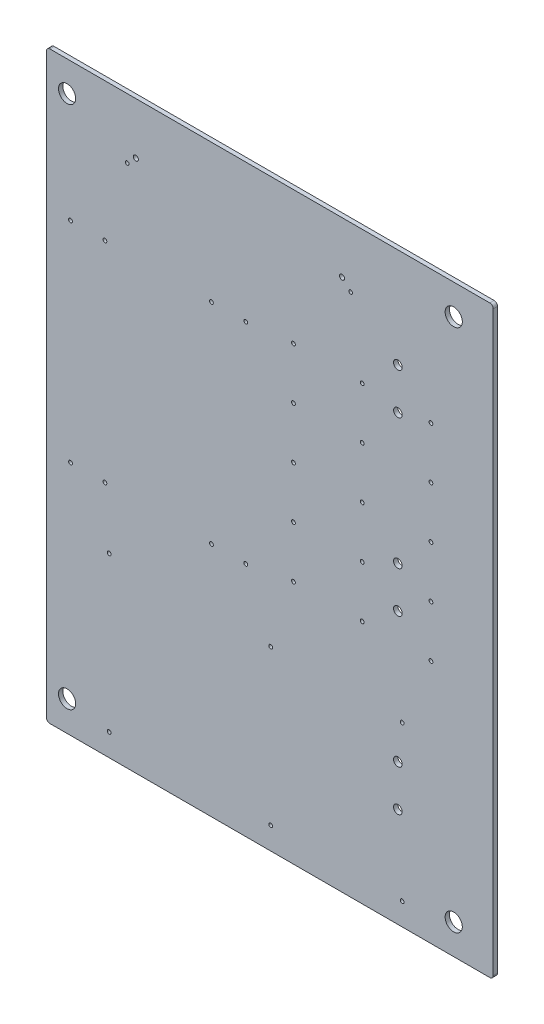
from build123d import *

# Parameters (mm, degrees)
SKETCH1_R                       = 6.35
SKETCH1_R_2                     = 3.175
SKETCH1_R_3                     = 1.8669
EXTRUDE1_DEPTH                  = 3.175
F_4_40_TAPPED_HOLE1_D           = 2.2606
F_4_40_TAPPED_HOLE1_DEPTH       = 8.8646
F_4_40_TAPPED_HOLE1_CBORE_D     = 2.8448
F_4_40_TAPPED_HOLE1_CBORE_DEPTH = 5.6896
F_4_40_TAPPED_HOLE1_TIP         = 0.679152758
F_6_32_TAPPED_HOLE1_D           = 2.7051
F_6_32_TAPPED_HOLE1_DEPTH       = 10.922
F_6_32_TAPPED_HOLE1_TIP         = 0.81269403


with BuildPart() as part:
    # Sketch1 → Extrude1 (new body)
    with BuildSketch(Plane.XY):
        with BuildLine():
            Line((-162.56, 215.9), (162.56, 215.9))
            ThreePointArc((162.56, 215.9), (164.356051224, 215.156051224), (165.1, 213.36))
            Line((165.1, 213.36), (165.1, -213.36))
            ThreePointArc((165.1, -213.36), (164.356051224, -215.156051224), (162.56, -215.9))
            Line((162.56, -215.9), (-162.56, -215.9))
            ThreePointArc((-162.56, -215.9), (-164.356051224, -215.156051224), (-165.1, -213.36))
            Line((-165.1, -213.36), (-165.1, 213.36))
            ThreePointArc((-165.1, 213.36), (-164.356051224, 215.156051224), (-162.56, 215.9))
        make_face()
        with Locations((-149.86, 193.675)):
            Circle(SKETCH1_R, mode=Mode.SUBTRACT)
        with Locations((135.89, 193.675)):
            Circle(SKETCH1_R, mode=Mode.SUBTRACT)
        with Locations(Location((135.89, -193.675, 0), (0, 0, 180))):
            Circle(SKETCH1_R, mode=Mode.SUBTRACT)
        with Locations(Location((-149.86, -193.675, 0), (0, 0, 180))):
            Circle(SKETCH1_R, mode=Mode.SUBTRACT)
        with Locations((94.615, 142.24)):
            Circle(SKETCH1_R_2, mode=Mode.SUBTRACT)
        with Locations((94.615, 111.76)):
            Circle(SKETCH1_R_2, mode=Mode.SUBTRACT)
        with Locations((94.615, -15.24)):
            Circle(SKETCH1_R_2, mode=Mode.SUBTRACT)
        with Locations((94.615, 15.24)):
            Circle(SKETCH1_R_2, mode=Mode.SUBTRACT)
        with Locations((94.615, -142.24)):
            Circle(SKETCH1_R_2, mode=Mode.SUBTRACT)
        with Locations((94.615, -111.76)):
            Circle(SKETCH1_R_2, mode=Mode.SUBTRACT)
        with Locations((53.34, 177.8)):
            Circle(SKETCH1_R_3, mode=Mode.SUBTRACT)
        with Locations((-99.06, 177.8)):
            Circle(SKETCH1_R_3, mode=Mode.SUBTRACT)
    extrude(amount=EXTRUDE1_DEPTH)

    # #4-40 Tapped Hole1
    with Locations(Plane.XY.offset(3.175)):
        with Locations((-147.32, 113.665), (-43.18, 113.665), (-43.18, -41.275), (-147.32, -41.275), (-118.745, -85.09), (0.635, -85.09), (97.79, -85.09), (97.79, -199.39), (0.635, -199.39), (-118.745, -199.39), (-121.92, 113.665), (-17.78, 113.665), (-17.78, -41.275), (-121.92, -41.275), (17.451090556, 117.318318975), (68.251090556, 117.318318975), (119.051090556, 117.318318975), (17.451090556, 79.218318975), (17.451090556, 41.118318975), (68.251090556, 79.218318975), (119.051090556, 79.218318975), (119.051090556, 41.118318975), (68.251090556, 41.118318975), (17.451090556, 3.018318975), (68.251090556, 3.018318975), (119.051090556, 3.018318975), (119.051090556, -35.081681025), (68.251090556, -35.081681025), (17.451090556, -35.081681025)):
            CounterBoreHole(F_4_40_TAPPED_HOLE1_D / 2, F_4_40_TAPPED_HOLE1_CBORE_D / 2, F_4_40_TAPPED_HOLE1_CBORE_DEPTH, depth=F_4_40_TAPPED_HOLE1_DEPTH)
            with Locations((0, 0, -(F_4_40_TAPPED_HOLE1_DEPTH + F_4_40_TAPPED_HOLE1_TIP / 2))):  # 118° drill point
                Cone(0, F_4_40_TAPPED_HOLE1_D / 2, F_4_40_TAPPED_HOLE1_TIP, mode=Mode.SUBTRACT)

    # #6-32 Tapped Hole1
    with Locations(Plane.XY.offset(3.175)):
        with Locations((59.69, 171.45), (-105.41, 171.45)):
            Hole(F_6_32_TAPPED_HOLE1_D / 2, depth=F_6_32_TAPPED_HOLE1_DEPTH)
            with Locations((0, 0, -(F_6_32_TAPPED_HOLE1_DEPTH + F_6_32_TAPPED_HOLE1_TIP / 2))):  # 118° drill point
                Cone(0, F_6_32_TAPPED_HOLE1_D / 2, F_6_32_TAPPED_HOLE1_TIP, mode=Mode.SUBTRACT)


solid = part.part
